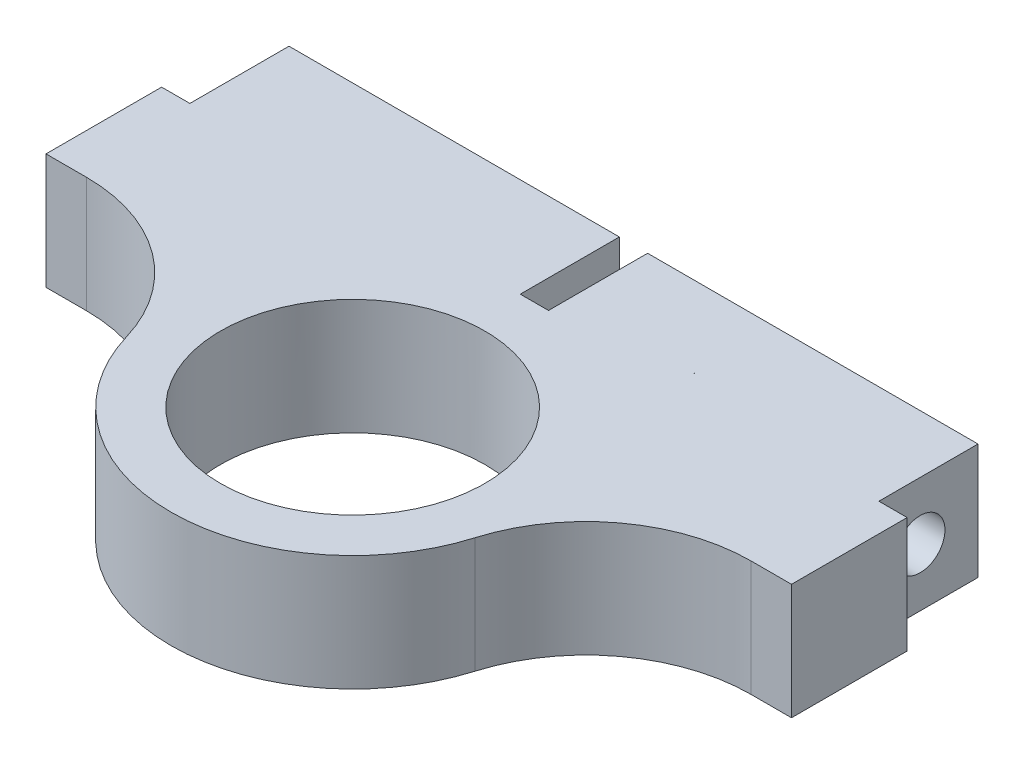
from build123d import *

# Parameters (mm, degrees)
SKETCH1_R            = 11
SKETCH1_R_2          = 8
SKETCH1_W            = 45.13
SKETCH1_H            = 7
BOSS_EXTRUDE1_DEPTH  = 10
SKETCH2_W            = 1.71
SKETCH2_H            = 4
CUT_EXTRUDE1_DEPTH   = 10
SKETCH3_W            = 20
SKETCH3_H            = 10
BOSS_EXTRUDE2_DEPTH  = 3
CUT_EXTRUDE2_START   = -3
CUT_EXTRUDE2_DEPTH   = 3
SKETCH6_W            = 20
SKETCH6_H            = 7
BOSS_EXTRUDE3_DEPTH  = 2
SKETCH7_R            = 1.5
CUT_EXTRUDE5_DEPTH   = 44
SKETCH9_W            = 1.71
SKETCH9_H            = 7
BOSS_EXTRUDE4_DEPTH  = 3
CUT_EXTRUDE6_START   = -1
SKETCH11_R           = 8
CUT_EXTRUDE6_DEPTH   = 1
BOSS_EXTRUDE6_DEPTH  = 1
BOSS_EXTRUDE7_START  = 6
SKETCH13_R           = 8
BOSS_EXTRUDE7_DEPTH  = 6
SKETCH14_R           = 8
BOSS_EXTRUDE8_DEPTH  = 40
SKETCH15_R           = 7.5
BOSS_EXTRUDE9_DEPTH  = 30
BOSS_EXTRUDE10_START = 6.5
BOSS_EXTRUDE10_DEPTH = 6.5
SKETCH17_R           = 15.773418916
SKETCH17_R_2         = 7
CUT_EXTRUDE7_DEPTH   = 30
SKETCH18_R           = 7.1
BOSS_EXTRUDE11_DEPTH = 30
SKETCH19_R           = 7.2
BOSS_EXTRUDE12_DEPTH = 30
SKETCH20_R           = 12.810748173
SKETCH20_R_2         = 7.15
CUT_EXTRUDE8_DEPTH   = 30
SKETCH21_R           = 7.15
CUT_EXTRUDE9_DEPTH   = 10
SKETCH22_R           = 8
SKETCH22_R_2         = 7.15
CUT_EXTRUDE10_DEPTH  = 10
SKETCH25_W           = 1.71
SKETCH25_H           = 3
SKETCH25_W_2         = 20
CUT_EXTRUDE13_DEPTH  = 21
BOSS_EXTRUDE13_DEPTH = 20
BOSS_EXTRUDE14_START = -20
BOSS_EXTRUDE14_DEPTH = 20
SKETCH28_R           = 1.5
CUT_EXTRUDE14_DEPTH  = 50
SKETCH29_W           = 45.13
SKETCH29_H           = 13.5
BOSS_EXTRUDE15_DEPTH = 4
FILLET1_R            = 10
FILLET2_R            = 2
CUT_EXTRUDE15_START  = 59
CUT_EXTRUDE15_DEPTH  = 59
CUT_EXTRUDE16_DEPTH  = 6.5
SKETCH33_R           = 8
CUT_EXTRUDE17_DEPTH  = 19.5


with BuildPart() as part:
    # Sketch1 → Boss-Extrude1 (new body)
    # profile 1 of 2: a face of its own
    with BuildSketch(Plane(origin=(0, 0, 0), x_dir=(1, 0, 0), z_dir=(0, 1, 0))):
        with Locations((22.565, -8)):
            Circle(SKETCH1_R)
        with Locations(Location((22.565, -8, 0), (0, 0, 270))):
            Circle(SKETCH1_R_2, mode=Mode.SUBTRACT)
    # profile 2 of 2: a face of its own
    with BuildSketch(Plane(origin=(0, 0, 0), x_dir=(1, 0, 0), z_dir=(0, 1, 0))):
        with Locations((22.565, 3.5)):
            Rectangle(SKETCH1_W, SKETCH1_H)
    extrude(amount=BOSS_EXTRUDE1_DEPTH)

    # Sketch2 → Cut-Extrude1 (cut)
    with BuildSketch(Plane(origin=(0, 10, 0), x_dir=(1, 0, 0), z_dir=(0, 1, 0))):
        with Locations((0.855, 5)):
            Rectangle(SKETCH2_W, SKETCH2_H)
        with Locations((22.565, 5)):
            Rectangle(SKETCH2_W, SKETCH2_H)
        with Locations((44.275, 5)):
            Rectangle(SKETCH2_W, SKETCH2_H)
    extrude(amount=-CUT_EXTRUDE1_DEPTH, mode=Mode.SUBTRACT)

    # Sketch3 → Boss-Extrude2 (add)
    with BuildSketch(Plane(origin=(0, 0, -7), x_dir=(-1, 0, 0), z_dir=(0, 0, -1))):
        with Locations((-33.42, 5)):
            Rectangle(SKETCH3_W, SKETCH3_H)
        with Locations((-11.71, 5)):
            Rectangle(SKETCH3_W, SKETCH3_H)
    extrude(amount=BOSS_EXTRUDE2_DEPTH)

    # Sketch4 → Cut-Extrude2 (cut)
    with BuildSketch(Plane(origin=(0, 10, 0), x_dir=(1, 0, 0), z_dir=(0, 1, 0)).offset(CUT_EXTRUDE2_START)):
        with BuildLine():
            Line((21.71, 3), (21.71, 10))
            Line((21.71, 10), (1.71, 10))
            Line((1.71, 10), (1.71, 3))
            Line((1.71, 3), (0, 3))
            Line((0, 3), (0, 0))
            Line((0, 0), (15.015165565, 0))
            ThreePointArc((15.015165565, 0), (22.565, -19), (30.114834435, 0))
            Line((30.114834435, 0), (45.13, 0))
            Line((45.13, 0), (45.13, 3))
            Line((45.13, 3), (43.42, 3))
            Line((43.42, 3), (43.42, 10))
            Line((43.42, 10), (23.42, 10))
            Line((23.42, 10), (23.42, 3))
            Line((23.42, 3), (21.71, 3))
        make_face()
    extrude(amount=CUT_EXTRUDE2_DEPTH, mode=Mode.SUBTRACT)

    # Sketch6 → Boss-Extrude3 (add)
    with BuildSketch(Plane(origin=(0, 0, -10), x_dir=(-1, 0, 0), z_dir=(0, 0, -1))):
        with Locations((-33.42, 3.5)):
            Rectangle(SKETCH6_W, SKETCH6_H)
        with Locations((-11.71, 3.5)):
            Rectangle(SKETCH6_W, SKETCH6_H)
    extrude(amount=BOSS_EXTRUDE3_DEPTH)

    # Sketch7 → Cut-Extrude5 (cut)
    with BuildSketch(Plane.ZY.offset(-1.71)):
        with Locations((-8.5, 3.5)):
            Circle(SKETCH7_R)
    extrude(amount=-CUT_EXTRUDE5_DEPTH, mode=Mode.SUBTRACT)

    # Sketch9 → Boss-Extrude4 (add)
    with BuildSketch(Plane(origin=(0, 0, -3), x_dir=(-1, 0, 0), z_dir=(0, 0, -1))):
        with Locations((-22.565, 3.5)):
            Rectangle(SKETCH9_W, SKETCH9_H)
        with Locations((-0.855, 3.5)):
            Rectangle(SKETCH9_W, SKETCH9_H)
        with Locations((-44.275, 3.5)):
            Rectangle(SKETCH9_W, SKETCH9_H)
    extrude(amount=BOSS_EXTRUDE4_DEPTH)

    # Sketch11 → Cut-Extrude6 (cut)
    with BuildSketch(Plane(origin=(0, 7, 0), x_dir=(1, 0, 0), z_dir=(0, 1, 0)).offset(CUT_EXTRUDE6_START)):
        with BuildLine():
            Line((45.13, 6), (43.42, 6))
            Line((43.42, 6), (43.42, 12))
            Line((43.42, 12), (23.42, 12))
            Line((23.42, 12), (23.42, 6))
            Line((23.42, 6), (21.71, 6))
            Line((21.71, 6), (21.71, 12))
            Line((21.71, 12), (1.71, 12))
            Line((1.71, 12), (1.71, 6))
            Line((1.71, 6), (0, 6))
            Line((0, 6), (0, 0))
            Line((0, 0), (15.015165565, 0))
            ThreePointArc((15.015165565, 0), (22.565, -19), (30.114834435, 0))
            Line((30.114834435, 0), (45.13, 0))
            Line((45.13, 0), (45.13, 6))
        make_face()
        with Locations(Location((22.565, -8, 0), (0, 0, 270))):
            Circle(SKETCH11_R, mode=Mode.SUBTRACT)
    extrude(amount=CUT_EXTRUDE6_DEPTH, mode=Mode.SUBTRACT)

    # Sketch12 → Boss-Extrude6 (add)
    with BuildSketch(Plane(origin=(0, 6, 0), x_dir=(1, 0, 0), z_dir=(0, 1, 0))):
        with BuildLine():
            Line((45.13, 0), (45.13, 6))
            Line((45.13, 6), (43.42, 6))
            Line((43.42, 6), (43.42, 12))
            Line((43.42, 12), (23.42, 12))
            Line((23.42, 12), (23.42, 6))
            Line((23.42, 6), (21.71, 6))
            Line((21.71, 6), (21.71, 12))
            Line((21.71, 12), (1.71, 12))
            Line((1.71, 12), (1.71, 6))
            Line((1.71, 6), (0, 6))
            Line((0, 6), (0, 0))
            Line((0, 0), (15.015165565, 0))
            ThreePointArc((15.015165565, 0), (22.565, -19), (30.114834435, 0))
            Line((30.114834435, 0), (45.13, 0))
        make_face()
    extrude(amount=BOSS_EXTRUDE6_DEPTH)

    # Sketch13 → Boss-Extrude7 (add)
    with BuildSketch(Plane.XZ.offset(-6).offset(BOSS_EXTRUDE7_START)):
        with Locations((22.565, 8)):
            Circle(SKETCH13_R)
    extrude(amount=-BOSS_EXTRUDE7_DEPTH)

    # Sketch14 → Boss-Extrude8 (add)
    with BuildSketch(Plane.XZ):
        with Locations(Location((22.565, 8, 0), (0, 0, 90))):
            Circle(SKETCH14_R)
    extrude(amount=BOSS_EXTRUDE8_DEPTH)

    # Sketch15 → Boss-Extrude9 (add)
    with BuildSketch(Plane.XZ.offset(40)):
        with Locations(Location((22.565, 8, 0), (0, 0, 270))):
            Circle(SKETCH15_R)
    extrude(amount=BOSS_EXTRUDE9_DEPTH)

    # Sketch16 → Boss-Extrude10 (add)
    with BuildSketch(Plane.XZ.offset(BOSS_EXTRUDE10_START)):
        with BuildLine():
            Line((43.42, -12), (43.42, -6))
            Line((43.42, -6), (45.13, -6))
            Line((45.13, -6), (45.13, 0))
            Line((45.13, 0), (30.114834435, 0))
            ThreePointArc((30.114834435, 0), (22.565, 19), (15.015165565, 0))
            Line((15.015165565, 0), (0, 0))
            Line((0, 0), (0, -6))
            Line((0, -6), (1.71, -6))
            Line((1.71, -6), (1.71, -12))
            Line((1.71, -12), (21.71, -12))
            Line((21.71, -12), (21.71, -6))
            Line((21.71, -6), (23.42, -6))
            Line((23.42, -6), (23.42, -12))
            Line((23.42, -12), (43.42, -12))
        make_face()
    extrude(amount=-BOSS_EXTRUDE10_DEPTH)

    # Sketch17 → Cut-Extrude7 (cut)
    with BuildSketch(Plane.XZ.offset(70)):
        with Locations((22.565, 8)):
            Circle(SKETCH17_R)
        with Locations(Location((22.565, 8, 0), (0, 0, 270))):
            Circle(SKETCH17_R_2, mode=Mode.SUBTRACT)
    extrude(amount=-CUT_EXTRUDE7_DEPTH, mode=Mode.SUBTRACT)

    # Sketch18 → Boss-Extrude11 (add)
    with BuildSketch(Plane.XZ.offset(70)):
        with Locations(Location((22.565, 8, 0), (0, 0, 270))):
            Circle(SKETCH18_R)
    extrude(amount=-BOSS_EXTRUDE11_DEPTH)

    # Sketch19 → Boss-Extrude12 (add)
    with BuildSketch(Plane.XZ.offset(70)):
        with Locations(Location((22.565, 8, 0), (0, 0, 270))):
            Circle(SKETCH19_R)
    extrude(amount=-BOSS_EXTRUDE12_DEPTH)

    # Sketch20 → Cut-Extrude8 (cut)
    with BuildSketch(Plane.XZ.offset(70)):
        with Locations((22.565, 8)):
            Circle(SKETCH20_R)
        with Locations(Location((22.565, 8, 0), (0, 0, 270))):
            Circle(SKETCH20_R_2, mode=Mode.SUBTRACT)
    extrude(amount=-CUT_EXTRUDE8_DEPTH, mode=Mode.SUBTRACT)

    # Sketch21 → Cut-Extrude9 (cut)
    with BuildSketch(Plane.XZ.offset(70)):
        with Locations(Location((22.565, 8, 0), (0, 0, 270))):
            Circle(SKETCH21_R)
    extrude(amount=-CUT_EXTRUDE9_DEPTH, mode=Mode.SUBTRACT)

    # Sketch22 → Cut-Extrude10 (cut)
    with BuildSketch(Plane.XZ.offset(40)):
        with Locations(Location((22.565, 8, 0), (0, 0, 270))):
            Circle(SKETCH22_R)
        with Locations(Location((22.565, 8, 0), (0, 0, 270))):
            Circle(SKETCH22_R_2, mode=Mode.SUBTRACT)
    extrude(amount=-CUT_EXTRUDE10_DEPTH, mode=Mode.SUBTRACT)

    # Sketch25 → Cut-Extrude13 (cut)
    with BuildSketch(Plane(origin=(0, 7, 0), x_dir=(1, 0, 0), z_dir=(0, 1, 0))):
        with Locations((0.855, 4.5)):
            Rectangle(SKETCH25_W, SKETCH25_H)
        with Locations((11.71, 10.5)):
            Rectangle(SKETCH25_W_2, SKETCH25_H)
        with Locations((33.42, 10.5)):
            Rectangle(SKETCH25_W_2, SKETCH25_H)
        with Locations((22.565, 4.5)):
            Rectangle(SKETCH25_W, SKETCH25_H)
        with Locations((44.275, 4.5)):
            Rectangle(SKETCH25_W, SKETCH25_H)
    extrude(amount=-CUT_EXTRUDE13_DEPTH, mode=Mode.SUBTRACT)

    # Sketch26 → Boss-Extrude13 (add)
    with BuildSketch(Plane.ZY.offset(-1.71)):
        with BuildLine():
            ThreePointArc((-7, 3.5), (-7.633974596, 4.724744871), (-9, 4.914213562))
            Line((-9, 4.914213562), (-9, 2.085786438))
            ThreePointArc((-9, 2.085786438), (-7.633974596, 2.275255129), (-7, 3.5))
        make_face()
    extrude(amount=-BOSS_EXTRUDE13_DEPTH)

    # Sketch27 → Boss-Extrude14 (add)
    with BuildSketch(Plane(origin=(43.42, 0, 0), x_dir=(0, 0, -1), z_dir=(1, 0, 0)).offset(BOSS_EXTRUDE14_START)):
        with BuildLine():
            Line((9, 2.085786438), (9, 4.914213562))
            ThreePointArc((9, 4.914213562), (7, 3.5), (9, 2.085786438))
        make_face()
    extrude(amount=BOSS_EXTRUDE14_DEPTH)

    # Sketch28 → Cut-Extrude14 (cut)
    with BuildSketch(Plane.ZY.offset(-1.71)):
        with Locations((-5.5, 3.5)):
            Circle(SKETCH28_R)
    extrude(amount=-CUT_EXTRUDE14_DEPTH, mode=Mode.SUBTRACT)

    # Sketch29 → Boss-Extrude15 (add)
    with BuildSketch(Plane.XY):
        with Locations((22.565, 0.25)):
            Rectangle(SKETCH29_W, SKETCH29_H)
    extrude(amount=BOSS_EXTRUDE15_DEPTH)

    # Fillet1
    fillet1_edges = [part.edges().sort_by_distance(p)[0] for p in [
        (32.811950766, 0.25, 4),
        (12.318049234, 0.25, 4),
    ]]
    fillet(fillet1_edges, radius=FILLET1_R)

    # Fillet2
    fillet2_edges = [part.edges().sort_by_distance(p)[0] for p in [
        (22.565, -6.5, 0),
    ]]
    fillet(fillet2_edges, radius=FILLET2_R)

    # Sketch30 → Cut-Extrude15 (cut)
    with BuildSketch(Plane.XZ.offset(6.5).offset(CUT_EXTRUDE15_START)):
        with BuildLine():
            Line((45.13, 4), (42.689611797, 4))
            ThreePointArc((42.689611797, 4), (36.713468751, 5.982162743), (33.106463322, 11.142857143))
            ThreePointArc((33.106463322, 11.142857143), (22.565, 19), (12.023536678, 11.142857143))
            ThreePointArc((12.023536678, 11.142857143), (8.416531249, 5.982162743), (2.440388203, 4))
            Line((2.440388203, 4), (0, 4))
            Line((0, 4), (0, -3))
            Line((0, -3), (1.71, -3))
            Line((1.71, -3), (1.71, -9))
            Line((1.71, -9), (21.71, -9))
            Line((21.71, -9), (21.71, -3))
            Line((21.71, -3), (23.42, -3))
            Line((23.42, -3), (23.42, -9))
            Line((23.42, -9), (43.42, -9))
            Line((43.42, -9), (43.42, -3))
            Line((43.42, -3), (45.13, -3))
            Line((45.13, -3), (45.13, 4))
        make_face()
    extrude(amount=-CUT_EXTRUDE15_DEPTH, mode=Mode.SUBTRACT)

    # Sketch32 → Cut-Extrude16 (cut)
    with BuildSketch(Plane.XZ.offset(6.5)):
        with BuildLine():
            Line((45.13, 4), (42.689611797, 4))
            ThreePointArc((42.689611797, 4), (36.713468751, 5.982162743), (33.106463322, 11.142857143))
            ThreePointArc((33.106463322, 11.142857143), (22.565, 19), (12.023536678, 11.142857143))
            ThreePointArc((12.023536678, 11.142857143), (8.416531249, 5.982162743), (2.440388203, 4))
            Line((2.440388203, 4), (0, 4))
            Line((0, 4), (0, -3))
            Line((0, -3), (1.71, -3))
            Line((1.71, -3), (1.71, -9))
            Line((1.71, -9), (21.71, -9))
            Line((21.71, -9), (21.71, -3))
            Line((21.71, -3), (23.42, -3))
            Line((23.42, -3), (23.42, -9))
            Line((23.42, -9), (43.42, -9))
            Line((43.42, -9), (43.42, -3))
            Line((43.42, -3), (45.13, -3))
            Line((45.13, -3), (45.13, 4))
        make_face()
    extrude(amount=-CUT_EXTRUDE16_DEPTH, mode=Mode.SUBTRACT)

    # Sketch33 → Cut-Extrude17 (cut)
    with BuildSketch(Plane(origin=(0, 7, 0), x_dir=(1, 0, 0), z_dir=(0, 1, 0))):
        with Locations(Location((22.565, -8, 0), (0, 0, 270))):
            Circle(SKETCH33_R)
    extrude(amount=-CUT_EXTRUDE17_DEPTH, mode=Mode.SUBTRACT)


solid = part.part
